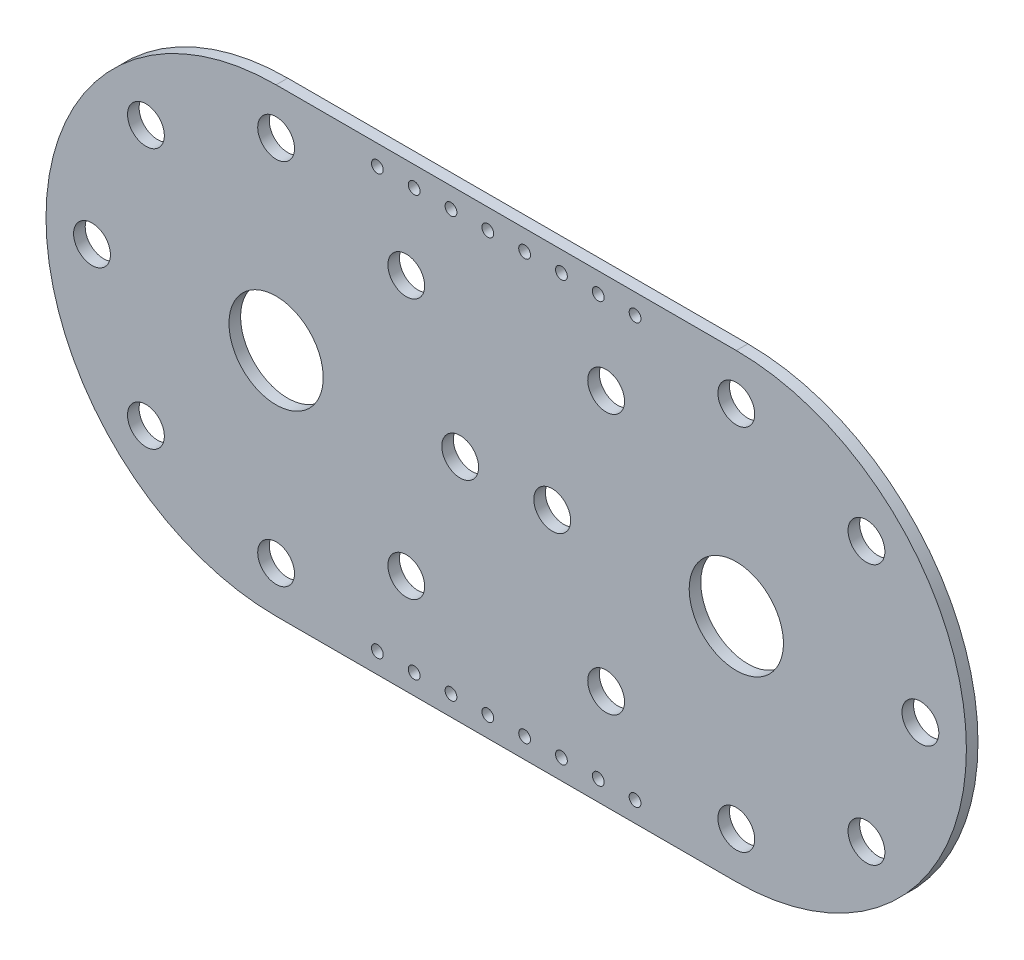
from build123d import *

# Parameters (mm, degrees)
SKETCH1_R           = 1.27
SKETCH1_R_2         = 3.2512
BOSS_EXTRUDE1_DEPTH = 0.800000051
SKETCH3_R           = 0.4064
CUT_EXTRUDE3_DEPTH  = 58.243716905


with BuildPart() as part:
    # Sketch1 → Boss-Extrude1 (new body)
    with BuildSketch(Plane.XY):
        with BuildLine():
            Line((31.75, 31.75), (0, 31.75))
            ThreePointArc((0, 31.75), (-15.875, 15.875), (0, 0))
            Line((0, 0), (31.75, 0))
            ThreePointArc((31.75, 0), (47.625, 15.875), (31.75, 31.75))
        make_face()
        with Locations((0, 3.175)):
            Circle(SKETCH1_R, mode=Mode.SUBTRACT)
        with Locations((-8.980256121, 6.894743879)):
            Circle(SKETCH1_R, mode=Mode.SUBTRACT)
        with Locations((8.980256121, 6.894743879)):
            Circle(SKETCH1_R, mode=Mode.SUBTRACT)
        with Locations((12.7, 15.875)):
            Circle(SKETCH1_R, mode=Mode.SUBTRACT)
        with Locations((22.769743879, 6.894743879)):
            Circle(SKETCH1_R, mode=Mode.SUBTRACT)
        with Locations((31.75, 3.175)):
            Circle(SKETCH1_R, mode=Mode.SUBTRACT)
        with Locations((40.730256121, 6.894743879)):
            Circle(SKETCH1_R, mode=Mode.SUBTRACT)
        with Locations((19.05, 15.875)):
            Circle(SKETCH1_R, mode=Mode.SUBTRACT)
        with Locations((-12.7, 15.875)):
            Circle(SKETCH1_R, mode=Mode.SUBTRACT)
        with Locations((0, 15.875)):
            Circle(SKETCH1_R_2, mode=Mode.SUBTRACT)
        with Locations((-8.980256121, 24.855256121)):
            Circle(SKETCH1_R, mode=Mode.SUBTRACT)
        with Locations((8.980256121, 24.855256121)):
            Circle(SKETCH1_R, mode=Mode.SUBTRACT)
        with Locations((0, 28.575)):
            Circle(SKETCH1_R, mode=Mode.SUBTRACT)
        with Locations((31.75, 15.875)):
            Circle(SKETCH1_R_2, mode=Mode.SUBTRACT)
        with Locations((44.45, 15.875)):
            Circle(SKETCH1_R, mode=Mode.SUBTRACT)
        with Locations((22.769743879, 24.855256121)):
            Circle(SKETCH1_R, mode=Mode.SUBTRACT)
        with Locations((31.75, 28.575)):
            Circle(SKETCH1_R, mode=Mode.SUBTRACT)
        with Locations((40.730256121, 24.855256121)):
            Circle(SKETCH1_R, mode=Mode.SUBTRACT)
    extrude(amount=BOSS_EXTRUDE1_DEPTH)

    # Sketch3 → Cut-Extrude3 (cut, through all)
    with BuildSketch(Plane(origin=(0, 0, 0.800000051), x_dir=(-1, 0, 0), z_dir=(0, 0, -1))):
        with Locations((-14.605, 30.353)):
            Circle(SKETCH3_R)
        with Locations((-12.065, 30.353)):
            Circle(SKETCH3_R)
        with Locations((-9.525, 30.353)):
            Circle(SKETCH3_R)
        with Locations((-6.985, 30.353)):
            Circle(SKETCH3_R)
        with Locations((-24.765, 30.353)):
            Circle(SKETCH3_R)
        with Locations((-22.225, 30.353)):
            Circle(SKETCH3_R)
        with Locations((-19.685, 30.353)):
            Circle(SKETCH3_R)
        with Locations((-17.145, 30.353)):
            Circle(SKETCH3_R)
        with Locations((-17.145, 1.397)):
            Circle(SKETCH3_R)
        with Locations((-19.685, 1.397)):
            Circle(SKETCH3_R)
        with Locations((-22.225, 1.397)):
            Circle(SKETCH3_R)
        with Locations((-24.765, 1.397)):
            Circle(SKETCH3_R)
        with Locations((-6.985, 1.397)):
            Circle(SKETCH3_R)
        with Locations((-9.525, 1.397)):
            Circle(SKETCH3_R)
        with Locations((-12.065, 1.397)):
            Circle(SKETCH3_R)
        with Locations((-14.605, 1.397)):
            Circle(SKETCH3_R)
    extrude(amount=CUT_EXTRUDE3_DEPTH, mode=Mode.SUBTRACT)


solid = part.part
